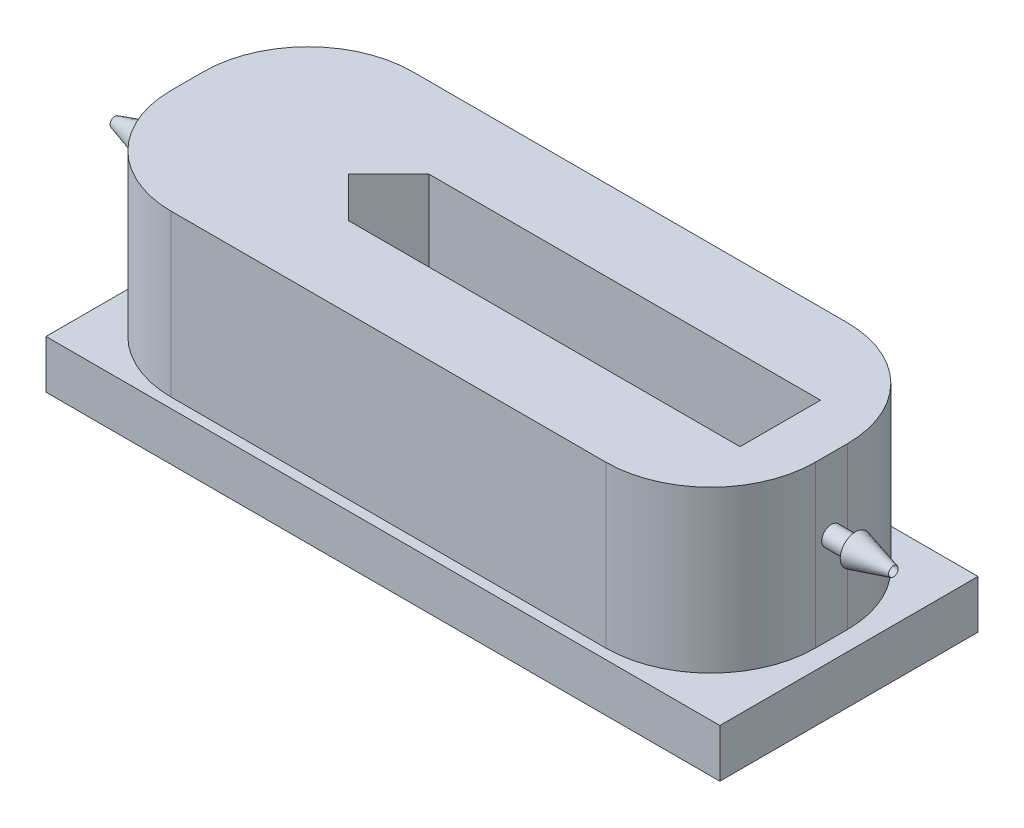
from build123d import *

# Parameters (mm, degrees)
SKETCH1_W               = 80
SKETCH1_H               = 30
BOSS_EXTRUDE1_DEPTH     = 60
CUT_EXTRUDE1_DEPTH      = 75
CUT_EXTRUDE2_DEPTH      = 102.118742081
CUT_EXTRUDE2_DEPTH_BACK = 102.118742081
SKETCH3_R               = 0.8
SKETCH4_R               = 1.5
SKETCH4_R_2             = 1.2
BOSS_EXTRUDE2_DEPTH     = 3
SKETCH7_R               = 0.6
CUT_EXTRUDE3_DEPTH      = 2
SKETCH8_R               = 0.8
CUT_EXTRUDE4_DEPTH      = 53
FILLET1_R               = 13
SKETCH9_R               = 1.2
SKETCH9_R_2             = 0.8
BOSS_EXTRUDE3_DEPTH     = 3
CUT_EXTRUDE5_START      = -2
SKETCH12_R              = 0.6
CUT_EXTRUDE5_DEPTH      = 2
CUT_EXTRUDE6_START      = -35
SKETCH14_R              = 0.8
CUT_EXTRUDE6_DEPTH      = 35
SKETCH15_W              = 83.696095513
SKETCH15_H              = 31.69844841
CUT_EXTRUDE7_DEPTH      = 50
SKETCH16_W              = 83.696095513
SKETCH16_H              = 32.064199738
BOSS_EXTRUDE4_DEPTH     = 6


with BuildPart() as part:
    # Sketch1 → Boss-Extrude1 (new body)
    with BuildSketch(Plane(origin=(0, 0, 0), x_dir=(1, 0, 0), z_dir=(0, 1, 0))):
        Rectangle(SKETCH1_W, SKETCH1_H)
    extrude(amount=BOSS_EXTRUDE1_DEPTH)

    # Sketch2 → Cut-Extrude1 (cut)
    with BuildSketch(Plane(origin=(0, 60, 0), x_dir=(1, 0, 0), z_dir=(0, 1, 0))):
        Polygon((-15, 5), (15, 5), (33.657016573, 5), (33.657016573, -5), (15, -5), (-15, -5), (-20, 0), align=None)
    extrude(amount=-CUT_EXTRUDE1_DEPTH, mode=Mode.SUBTRACT)

    # Sketch3 → Cut-Extrude2 (cut, two sides: drawn at the far end of the back side and taken through both)
    with BuildSketch(Plane.ZY.offset(40).offset(-CUT_EXTRUDE2_DEPTH_BACK)):
        with Locations(Location((0, 51.111959895, 0), (0, 0, 270))):
            Circle(SKETCH3_R)
    extrude(amount=CUT_EXTRUDE2_DEPTH + CUT_EXTRUDE2_DEPTH_BACK, mode=Mode.SUBTRACT)

    # Sketch4 → Boss-Extrude2 (add)
    with BuildSketch(Plane.ZY.offset(40)):
        with Locations(Location((0, 51.111959895, 0), (0, 0, 180))):
            Circle(SKETCH4_R)
        with Locations((0, 51.111959895)):
            Circle(SKETCH4_R_2, mode=Mode.SUBTRACT)
    extrude(amount=BOSS_EXTRUDE2_DEPTH)

    # Sketch6 → Revolve1 (revolve)
    with BuildSketch(Plane.XY, mode=Mode.PRIVATE) as revolve1_sk:
        Polygon((-43, 51.111959895), (-49.325220868, 51.111959895), (-49.325220868, 51.611959895), (-43, 53.511959895), align=None)
    revolve(revolve1_sk.sketch.rotate(Axis((-43, 51.111959895, 0), (-1, 0, 0)), 270), axis=Axis((-43, 51.111959895, 0), (-1, 0, 0)))

    # Sketch7 → Cut-Extrude3 (cut)
    with BuildSketch(Plane.ZY.offset(49.325220868)):
        with Locations((0, 51.111959895)):
            Circle(SKETCH7_R)
    extrude(amount=-CUT_EXTRUDE3_DEPTH, mode=Mode.SUBTRACT)

    # Sketch8 → Cut-Extrude4 (cut)
    with BuildSketch(Plane.ZY.offset(47.325220868)):
        with Locations(Location((0, 51.111959895, 0), (0, 0, 270))):
            Circle(SKETCH8_R)
    extrude(amount=-CUT_EXTRUDE4_DEPTH, mode=Mode.SUBTRACT)

    # Fillet1
    fillet1_edges = [part.edges().sort_by_distance(p)[0] for p in [
        (40, 30, 15),
        (-40, 30, 15),
        (-40, 30, -15),
        (40, 30, -15),
    ]]
    fillet(fillet1_edges, radius=FILLET1_R)

    # Sketch9 → Boss-Extrude3 (add)
    with BuildSketch(Plane(origin=(40, 0, 0), x_dir=(0, 0, -1), z_dir=(1, 0, 0))):
        with Locations(Location((0, 51.111959895, 0), (0, 0, 180))):
            Circle(SKETCH9_R)
        with Locations(Location((0, 51.111959895, 0), (0, 0, 270))):
            Circle(SKETCH9_R_2, mode=Mode.SUBTRACT)
    extrude(amount=BOSS_EXTRUDE3_DEPTH)

    # Sketch15 → Cut-Extrude7 (cut)
    with BuildSketch(Plane(origin=(0, -10, 0), x_dir=(-1, 0, 0), z_dir=(0, -1, 0))):
        with Locations((-0.057440767, 0.030479277)):
            Rectangle(SKETCH15_W, SKETCH15_H)
    extrude(amount=-CUT_EXTRUDE7_DEPTH, mode=Mode.SUBTRACT)

    # Sketch16 → Boss-Extrude4 (add)
    with BuildSketch(Plane(origin=(0, 40, 0), x_dir=(-1, 0, 0), z_dir=(0, -1, 0))):
        with Locations((-0.545109204, -0.213354941)):
            Rectangle(SKETCH16_W, SKETCH16_H)
    extrude(amount=BOSS_EXTRUDE4_DEPTH)


with BuildPart() as body_2:
    # Sketch11 → Revolve2 (revolve)
    with BuildSketch(Plane.XY, mode=Mode.PRIVATE) as revolve2_sk:
        Polygon((43, 51.111959895), (43, 53.013316413), (47.705149283, 51.711959895), (47.705149283, 51.111959895), align=None)
    revolve(revolve2_sk.sketch.rotate(Axis((43, 51.111959895, 0), (1, 0, 0)), 270), axis=Axis((43, 51.111959895, 0), (1, 0, 0)))

    # Sketch12 → Cut-Extrude5 (cut)
    with BuildSketch(Plane(origin=(47.705149283, 0, 0), x_dir=(0, 0, -1), z_dir=(1, 0, 0)).offset(CUT_EXTRUDE5_START)):
        with Locations((0, 51.111959895)):
            Circle(SKETCH12_R)
    extrude(amount=CUT_EXTRUDE5_DEPTH, mode=Mode.SUBTRACT)

    # Sketch14 → Cut-Extrude6 (cut)
    with BuildSketch(Plane(origin=(45.705149283, 0, 0), x_dir=(0, 0, -1), z_dir=(1, 0, 0)).offset(CUT_EXTRUDE6_START)):
        with Locations((0, 51.111959895)):
            Circle(SKETCH14_R)
    extrude(amount=CUT_EXTRUDE6_DEPTH, mode=Mode.SUBTRACT)


solid = Compound([part.part, body_2.part])
